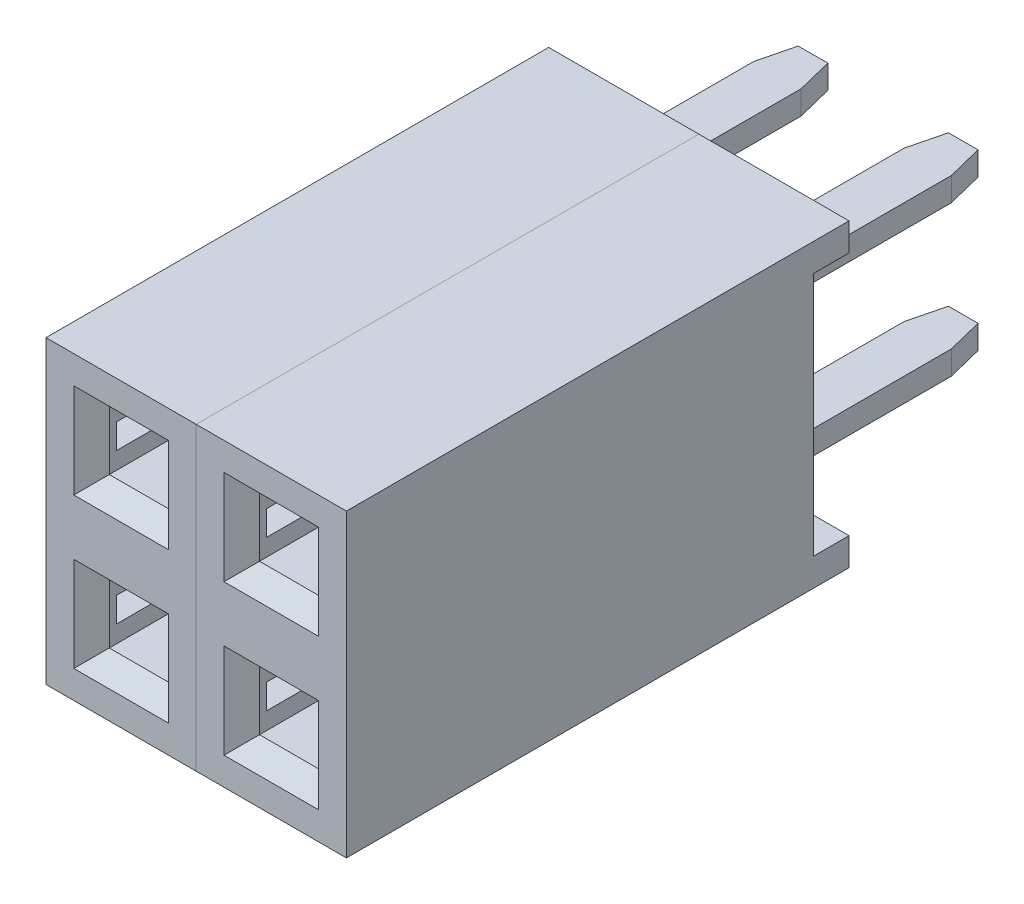
from build123d import *

# Parameters (mm, degrees)
SKETCH_1_W          = 2.54
SKETCH_1_H          = 2.54
EXTRUDE_1_DEPTH     = 8.5
SKETCH_2_W          = 2
SKETCH_2_H          = 0.42
CUT_EXTRUDE_1_DEPTH = 8.08
SKETCH_3_W          = 1
SKETCH_3_H          = 1
CUT_EXTRUDE_2_DEPTH = 6.5
SKETCH_4_W          = 0.6
SKETCH_4_H          = 1.6
CUT_EXTRUDE_3_DEPTH = 10.227849154
EXTRUDE_2_DEPTH     = 0.2
CHAMFER_1_SIZE      = 0.3
SKETCH1_W           = 0.8
SKETCH1_H           = 0.4
BOSS_EXTRUDE1_DEPTH = 3.2
CUT_EXTRUDE1_DEPTH  = 1
LPATTERN1_COUNT     = 2
LPATTERN1_PITCH     = 2.54
SKETCH3_W           = 0.719739989
SKETCH3_H           = 1.172127029
CUT_EXTRUDE2_DEPTH  = 3
LPATTERN2_COUNT     = 2
LPATTERN2_PITCH     = 2.54


with BuildPart() as part:
    # Эскиз1 → Бобышка-Вытянуть1 (new body)
    with BuildSketch(Plane.XY):
        with Locations((0, 1.27)):
            Rectangle(SKETCH_1_W, SKETCH_1_H)
    extrude(amount=EXTRUDE_1_DEPTH)

    # Эскиз2 → Вырез-Вытянуть1 (cut)
    with BuildSketch(Plane(origin=(0, 0, 0), x_dir=(-1, 0, 0), z_dir=(0, 0, -1))):
        with Locations((0, 1.27)):
            Rectangle(SKETCH_2_W, SKETCH_2_H)
    extrude(amount=-CUT_EXTRUDE_1_DEPTH, mode=Mode.SUBTRACT)

    # Эскиз3 → Вырез-Вытянуть2 (cut)
    with BuildSketch(Plane.XY.offset(8.5)):
        with Locations((0, 1.27)):
            Rectangle(SKETCH_3_W, SKETCH_3_H)
    extrude(amount=-CUT_EXTRUDE_2_DEPTH, mode=Mode.SUBTRACT)

    # Эскиз4 → Вырез-Вытянуть3 (cut, through all)
    with BuildSketch(Plane.ZY.offset(1.27)):
        with Locations((0.3, 1.27)):
            Rectangle(SKETCH_4_W, SKETCH_4_H)
    extrude(amount=-CUT_EXTRUDE_3_DEPTH, mode=Mode.SUBTRACT)

    # Фаска1
    chamfer_1_edges = [part.edges().sort_by_distance(p)[0] for p in [
        (0.5, 1.27, 8.5),
        (0, 1.77, 8.5),
        (-0.5, 1.27, 8.5),
        (0, 0.77, 8.5),
    ]]
    chamfer(chamfer_1_edges, length=CHAMFER_1_SIZE)



with BuildPart() as body_2:
    # Эскиз6 → Бобышка-Вытянуть2 (new, symmetric)
    with BuildSketch(Plane(origin=(0, 1.27, 0), x_dir=(-1, 0, 0), z_dir=(0, -1, 0))):
        with BuildLine():
            Line((-0.4, 0), (0.4, 0))
            Line((0.4, 0), (0.4, -0.6))
            Line((0.4, -0.6), (0.6, -0.6))
            Line((0.6, -0.6), (1, -0.85))
            Line((1, -0.85), (1, -2.6))
            Line((1, -2.6), (0.813333333, -6.1))
            Line((0.813333333, -6.1), (0.45, -6.75))
            Line((0.45, -6.75), (0.3, -6.35))
            Line((0.3, -6.35), (0.5, -2.6))
            Line((0.5, -2.6), (0.5, -1.7))
            ThreePointArc((0.5, -1.7), (0, -1.2), (-0.5, -1.7))
            Line((-0.5, -1.7), (-0.5, -2.6))
            Line((-0.5, -2.6), (-0.3, -6.35))
            Line((-0.3, -6.35), (-0.45, -6.75))
            Line((-0.45, -6.75), (-0.813333333, -6.1))
            Line((-0.813333333, -6.1), (-1, -2.6))
            Line((-1, -2.6), (-1, -0.85))
            Line((-1, -0.85), (-0.6, -0.6))
            Line((-0.6, -0.6), (-0.4, -0.6))
            Line((-0.4, -0.6), (-0.4, 0))
        make_face()
    extrude(amount=EXTRUDE_2_DEPTH, both=True)


with BuildPart() as part_1:
    add(part.part)

    add(body_2.part)  # Boss-Extrude1 merges body 2
    # Sketch1 → Boss-Extrude1 (add)
    with BuildSketch(Plane(origin=(0, 0, 0), x_dir=(-1, 0, 0), z_dir=(0, 0, -1))):
        with Locations((0, 1.27)):
            Rectangle(SKETCH1_W, SKETCH1_H)
    extrude(amount=BOSS_EXTRUDE1_DEPTH)

    # Sketch2 → Cut-Extrude1 (cut)
    with BuildSketch(Plane(origin=(0, 1.47, 0), x_dir=(1, 0, 0), z_dir=(0, 1, 0))):
        Polygon((-0.4, 2.6), (-0.25, 3.2), (-0.4, 3.2), align=None)
        Polygon((0.4, 3.2), (0.25, 3.2), (0.4, 2.6), align=None)
        Polygon((0.25, 3.323331364), (0.25, 3.2), (0.4, 3.2), (0.4, 2.6), (0.533335502, 2.6), (0.533335502, 3.323331364), align=None)
        Polygon((-0.4, 3.2), (-0.25, 3.2), (-0.25, 3.209490078), (-0.25, 3.323331364), (-0.533335502, 3.323331364), (-0.533335502, 2.6), (-0.4, 2.6), align=None)
    extrude(amount=-CUT_EXTRUDE1_DEPTH, mode=Mode.SUBTRACT)

    # LPattern1: part ×2


with BuildPart() as part_2:
    add(part_1.part)
    with Locations(*[(0, -i * LPATTERN1_PITCH, 0) for i in range(1, LPATTERN1_COUNT)]):
        add(part_1.part)

    # Sketch3 → Cut-Extrude2 (cut)
    with BuildSketch(Plane.ZY.offset(1.27)):
        with Locations((0.240130006, 0.007630349)):
            Rectangle(SKETCH3_W, SKETCH3_H)
    extrude(amount=-CUT_EXTRUDE2_DEPTH, mode=Mode.SUBTRACT)


with BuildPart() as lpattern2_1:
    # LPattern2: pattern copy
    add(part_2.part.moved(Location(Vector(1, 0, 0) * (1 * LPATTERN2_PITCH))))


solid = Compound([part_2.part, lpattern2_1.part])
